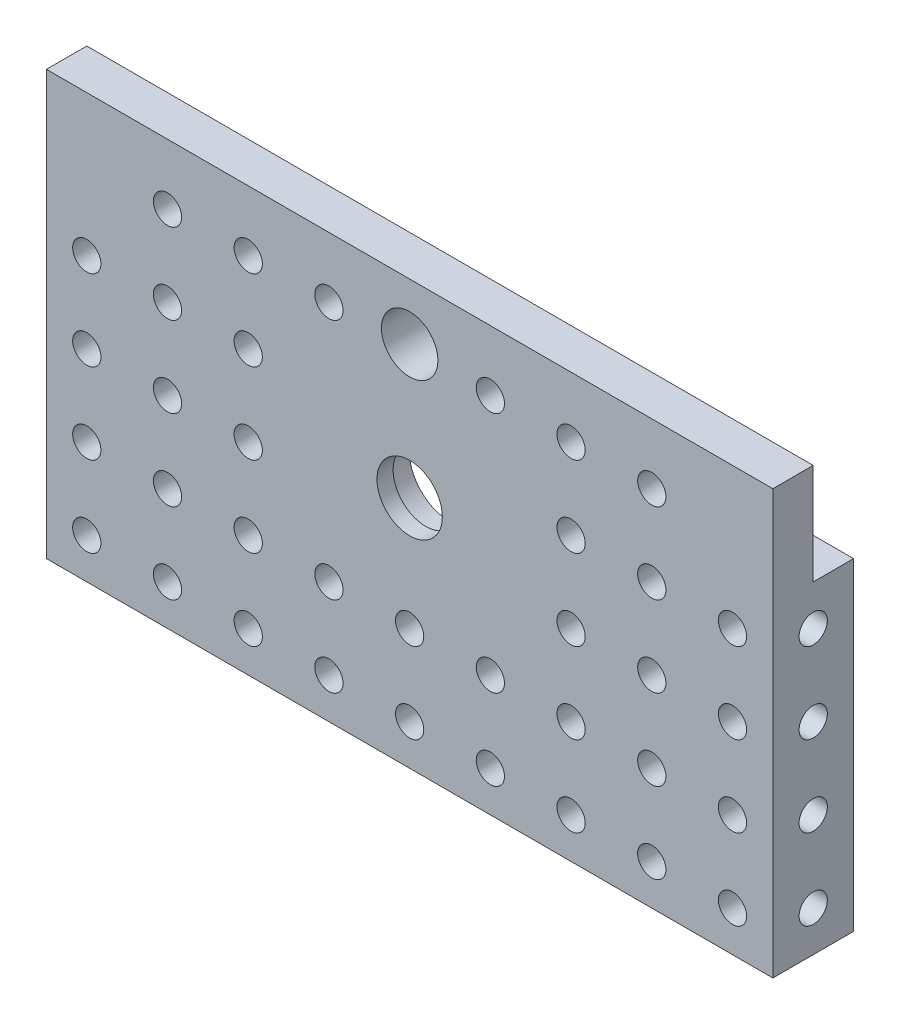
from build123d import *

# Parameters (mm, degrees)
ESQUISSE1_W             = 90
ESQUISSE1_H             = 50
ESQUISSE1_R             = 5.05
ESQUISSE1_R_2           = 1.75
ESQUISSE1_R_3           = 3.5
BOSS_EXTRU_1_DEPTH      = 10
ENL_V_START             = -10
ESQUISSE3_W             = 80
ESQUISSE3_H             = 50
ENL_V_MAT_EXTRU_3_DEPTH = 5
ESQUISSE4_R             = 1.75
BOSS_EXTRU_2_DEPTH      = 58
ESQUISSE2_R             = 1.75
ENL_V_MAT_EXTRU_1_DEPTH = 10
ENL_V_START_2           = -80
ESQUISSE2_2_R           = 1.75
ENL_V_MAT_EXTRU_2_DEPTH = 10
ESQUISSE5_R             = 1.75
ENL_V_MAT_EXTRU_4_DEPTH = 108.53604047
ESQUISSE6_W             = 70
ESQUISSE6_H             = 5
BOSS_EXTRU_3_DEPTH      = 8
ESQUISSE7_W             = 90
ESQUISSE7_H             = 18
ENL_V_MAT_EXTRU_5_DEPTH = 5
ESQUISSE8_W             = 10
ESQUISSE8_H             = 18
BOSS_EXTRU_4_DEPTH      = 5
BOSS_EXTRU_5_START      = -2
ESQUISSE9_R             = 5.05
ESQUISSE9_R_2           = 4.05
BOSS_EXTRU_5_DEPTH      = 2
ESQUISSE10_W            = 90
ESQUISSE10_H            = 5.5
ENL_V_MAT_EXTRU_6_DEPTH = 108.186752913
ESQUISSE11_R            = 1.75
ENL_V_MAT_EXTRU_7_DEPTH = 105.672107077


with BuildPart() as part:
    # Esquisse1 → Boss.-Extru.1 (new body)
    with BuildSketch(Plane.XY):
        with Locations((45, 25)):
            Rectangle(ESQUISSE1_W, ESQUISSE1_H)
        with Locations((45, 29)):
            Circle(ESQUISSE1_R, mode=Mode.SUBTRACT)
        with Locations((15, 45)):
            Circle(ESQUISSE1_R_2, mode=Mode.SUBTRACT)
        with Locations((25, 45)):
            Circle(ESQUISSE1_R_2, mode=Mode.SUBTRACT)
        with Locations((35, 45)):
            Circle(ESQUISSE1_R_2, mode=Mode.SUBTRACT)
        with Locations((55, 45)):
            Circle(ESQUISSE1_R_2, mode=Mode.SUBTRACT)
        with Locations((65, 45)):
            Circle(ESQUISSE1_R_2, mode=Mode.SUBTRACT)
        with Locations((75, 45)):
            Circle(ESQUISSE1_R_2, mode=Mode.SUBTRACT)
        with Locations((15, 35)):
            Circle(ESQUISSE1_R_2, mode=Mode.SUBTRACT)
        with Locations((25, 35)):
            Circle(ESQUISSE1_R_2, mode=Mode.SUBTRACT)
        with Locations((65, 35)):
            Circle(ESQUISSE1_R_2, mode=Mode.SUBTRACT)
        with Locations((75, 35)):
            Circle(ESQUISSE1_R_2, mode=Mode.SUBTRACT)
        with Locations((15, 25)):
            Circle(ESQUISSE1_R_2, mode=Mode.SUBTRACT)
        with Locations((25, 25)):
            Circle(ESQUISSE1_R_2, mode=Mode.SUBTRACT)
        with Locations((65, 25)):
            Circle(ESQUISSE1_R_2, mode=Mode.SUBTRACT)
        with Locations((75, 25)):
            Circle(ESQUISSE1_R_2, mode=Mode.SUBTRACT)
        with Locations((15, 15)):
            Circle(ESQUISSE1_R_2, mode=Mode.SUBTRACT)
        with Locations((25, 15)):
            Circle(ESQUISSE1_R_2, mode=Mode.SUBTRACT)
        with Locations((35, 15)):
            Circle(ESQUISSE1_R_2, mode=Mode.SUBTRACT)
        with Locations((45, 15)):
            Circle(ESQUISSE1_R_2, mode=Mode.SUBTRACT)
        with Locations((55, 15)):
            Circle(ESQUISSE1_R_2, mode=Mode.SUBTRACT)
        with Locations((65, 15)):
            Circle(ESQUISSE1_R_2, mode=Mode.SUBTRACT)
        with Locations((75, 15)):
            Circle(ESQUISSE1_R_2, mode=Mode.SUBTRACT)
        with Locations((15, 5)):
            Circle(ESQUISSE1_R_2, mode=Mode.SUBTRACT)
        with Locations((25, 5)):
            Circle(ESQUISSE1_R_2, mode=Mode.SUBTRACT)
        with Locations((35, 5)):
            Circle(ESQUISSE1_R_2, mode=Mode.SUBTRACT)
        with Locations((45, 5)):
            Circle(ESQUISSE1_R_2, mode=Mode.SUBTRACT)
        with Locations((55, 5)):
            Circle(ESQUISSE1_R_2, mode=Mode.SUBTRACT)
        with Locations((65, 5)):
            Circle(ESQUISSE1_R_2, mode=Mode.SUBTRACT)
        with Locations((75, 5)):
            Circle(ESQUISSE1_R_2, mode=Mode.SUBTRACT)
        with Locations((45, 45.5)):
            Circle(ESQUISSE1_R_3, mode=Mode.SUBTRACT)
    extrude(amount=BOSS_EXTRU_1_DEPTH)

    # Esquisse3 → Enlèv. mat.-Extru.3 (cut)
    with BuildSketch(Plane.XY.offset(10).offset(ENL_V_START)):
        with Locations((45, 25)):
            Rectangle(ESQUISSE3_W, ESQUISSE3_H)
    extrude(amount=ENL_V_MAT_EXTRU_3_DEPTH, mode=Mode.SUBTRACT)

    # Esquisse4 → Boss.-Extru.2 (add)
    # profile 1 of 2: a face of its own
    with BuildSketch(Plane.XZ):
        Polygon((0, 0), (0, 10), (10, 10), (10, 5), (10, 0), align=None)
        with Locations((5, 5)):
            Circle(ESQUISSE4_R, mode=Mode.SUBTRACT)
    # profile 2 of 2: a face of its own
    with BuildSketch(Plane.XZ):
        Polygon((80, 5), (80, 10), (90, 10), (90, 0), (80, 0), align=None)
        with Locations((85, 5)):
            Circle(ESQUISSE4_R, mode=Mode.SUBTRACT)
    extrude(amount=-BOSS_EXTRU_2_DEPTH)

    # Esquisse2 → Enlèv. mat.-Extru.1 (cut)
    with BuildSketch(Plane(origin=(90, 0, 0), x_dir=(0, 0, -1), z_dir=(1, 0, 0))):
        with Locations(Location((-5, 45, 0), (0, 0, 90))):
            Circle(ESQUISSE2_R)
        with Locations(Location((-5, 35, 0), (0, 0, 90))):
            Circle(ESQUISSE2_R)
        with Locations(Location((-5, 25, 0), (0, 0, 90))):
            Circle(ESQUISSE2_R)
        with Locations(Location((-5, 15, 0), (0, 0, 90))):
            Circle(ESQUISSE2_R)
        with Locations(Location((-5, 5, 0), (0, 0, 90))):
            Circle(ESQUISSE2_R)
    extrude(amount=-ENL_V_MAT_EXTRU_1_DEPTH, mode=Mode.SUBTRACT)

    # Esquisse2<2> → Enlèv. mat.-Extru.2 (cut)
    with BuildSketch(Plane(origin=(90, 0, 0), x_dir=(0, 0, -1), z_dir=(1, 0, 0)).offset(ENL_V_START_2)):
        with Locations(Location((-5, 45, 0), (0, 0, 90))):
            Circle(ESQUISSE2_2_R)
        with Locations(Location((-5, 35, 0), (0, 0, 90))):
            Circle(ESQUISSE2_2_R)
        with Locations(Location((-5, 25, 0), (0, 0, 90))):
            Circle(ESQUISSE2_2_R)
        with Locations(Location((-5, 15, 0), (0, 0, 90))):
            Circle(ESQUISSE2_2_R)
        with Locations(Location((-5, 5, 0), (0, 0, 90))):
            Circle(ESQUISSE2_2_R)
    extrude(amount=-ENL_V_MAT_EXTRU_2_DEPTH, mode=Mode.SUBTRACT)

    # Esquisse5 → Enlèv. mat.-Extru.4 (cut, through all)
    with BuildSketch(Plane.XZ):
        with Locations(Location((5, 5, 0), (0, 0, 90))):
            Circle(ESQUISSE5_R)
        with Locations((85, 5)):
            Circle(ESQUISSE5_R)
    extrude(amount=-ENL_V_MAT_EXTRU_4_DEPTH, mode=Mode.SUBTRACT)

    # Esquisse6 → Boss.-Extru.3 (add)
    with BuildSketch(Plane(origin=(0, 50, 0), x_dir=(1, 0, 0), z_dir=(0, 1, 0))):
        with Locations((45, -7.5)):
            Rectangle(ESQUISSE6_W, ESQUISSE6_H)
    extrude(amount=BOSS_EXTRU_3_DEPTH)

    # Esquisse7 → Enlèv. mat.-Extru.5 (cut)
    with BuildSketch(Plane(origin=(0, 0, 0), x_dir=(-1, 0, 0), z_dir=(0, 0, -1))):
        with Locations((-45, 49)):
            Rectangle(ESQUISSE7_W, ESQUISSE7_H)
    extrude(amount=-ENL_V_MAT_EXTRU_5_DEPTH, mode=Mode.SUBTRACT)

    # Esquisse8 → Boss.-Extru.4 (add)
    with BuildSketch(Plane(origin=(0, 0, 5), x_dir=(-1, 0, 0), z_dir=(0, 0, -1))):
        with Locations((-85, 49)):
            Rectangle(ESQUISSE8_W, ESQUISSE8_H)
        with Locations((-5, 49)):
            Rectangle(ESQUISSE8_W, ESQUISSE8_H)
    extrude(amount=-BOSS_EXTRU_4_DEPTH)

    # Esquisse9 → Boss.-Extru.5 (add)
    with BuildSketch(Plane.XY.offset(10).offset(BOSS_EXTRU_5_START)):
        with Locations(Location((45, 29, 0), (0, 0, 180))):
            Circle(ESQUISSE9_R)
        with Locations((45, 29)):
            Circle(ESQUISSE9_R_2, mode=Mode.SUBTRACT)
    extrude(amount=BOSS_EXTRU_5_DEPTH)

    # Esquisse10 → Enlèv. mat.-Extru.6 (cut, through all)
    with BuildSketch(Plane(origin=(0, 0, 5), x_dir=(-1, 0, 0), z_dir=(0, 0, -1))):
        with Locations((-45, 55.25)):
            Rectangle(ESQUISSE10_W, ESQUISSE10_H)
    extrude(amount=-ENL_V_MAT_EXTRU_6_DEPTH, mode=Mode.SUBTRACT)

    # Esquisse11 → Enlèv. mat.-Extru.7 (cut, through all)
    with BuildSketch(Plane(origin=(0, 0, 0), x_dir=(-1, 0, 0), z_dir=(0, 0, -1))):
        with Locations((-85.000000403, 35)):
            Circle(ESQUISSE11_R)
        with Locations((-85, 25)):
            Circle(ESQUISSE11_R)
        with Locations((-85, 15)):
            Circle(ESQUISSE11_R)
        with Locations((-85, 5)):
            Circle(ESQUISSE11_R)
        with Locations(Location((-5, 5, 0), (0, 0, 45))):
            Circle(ESQUISSE11_R)
        with Locations(Location((-5, 15, 0), (0, 0, 45))):
            Circle(ESQUISSE11_R)
        with Locations(Location((-5, 25, 0), (0, 0, 45))):
            Circle(ESQUISSE11_R)
        with Locations(Location((-4.999999597, 35, 0), (0, 0, 314.999991438))):
            Circle(ESQUISSE11_R)
    extrude(amount=-ENL_V_MAT_EXTRU_7_DEPTH, mode=Mode.SUBTRACT)


solid = part.part
